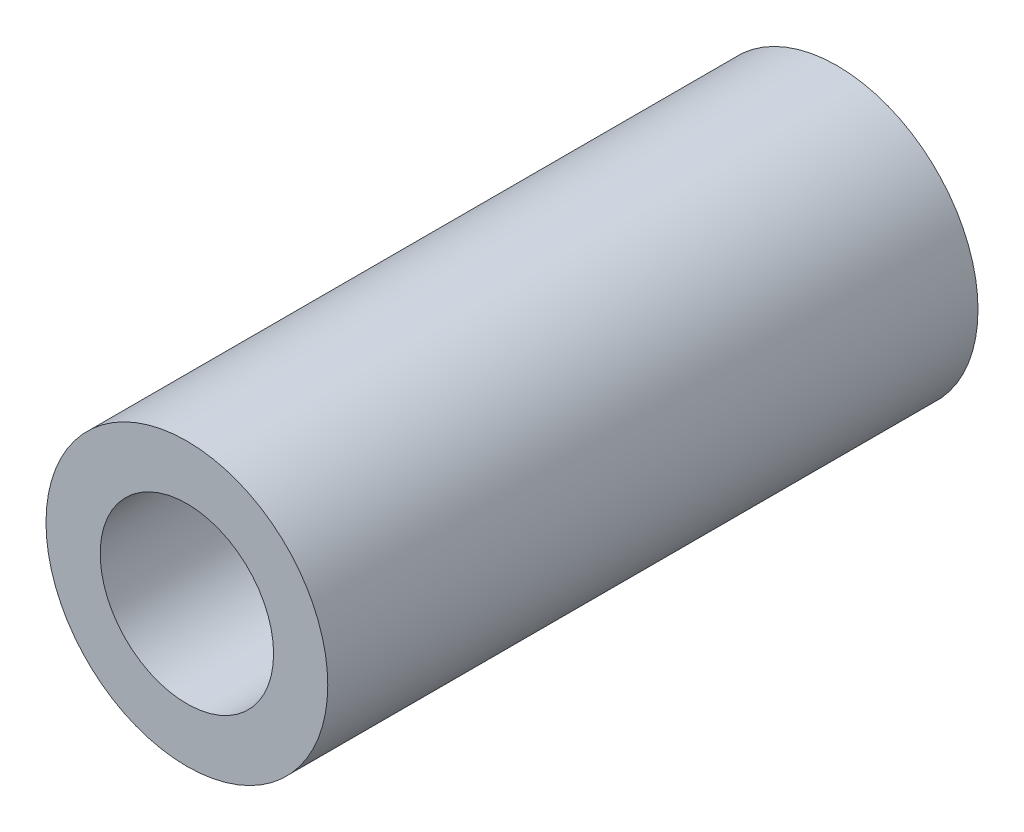
from build123d import *

# Parameters (mm, degrees)
SKETCH1_R           = 2.6
SKETCH1_R_2         = 1.6
BOSS_EXTRUDE1_DEPTH = 12


with BuildPart() as part:
    # Sketch1 → Boss-Extrude1 (new body)
    with BuildSketch(Plane.XY):
        Circle(SKETCH1_R)
        Circle(SKETCH1_R_2, mode=Mode.SUBTRACT)
    extrude(amount=BOSS_EXTRUDE1_DEPTH)


solid = part.part
